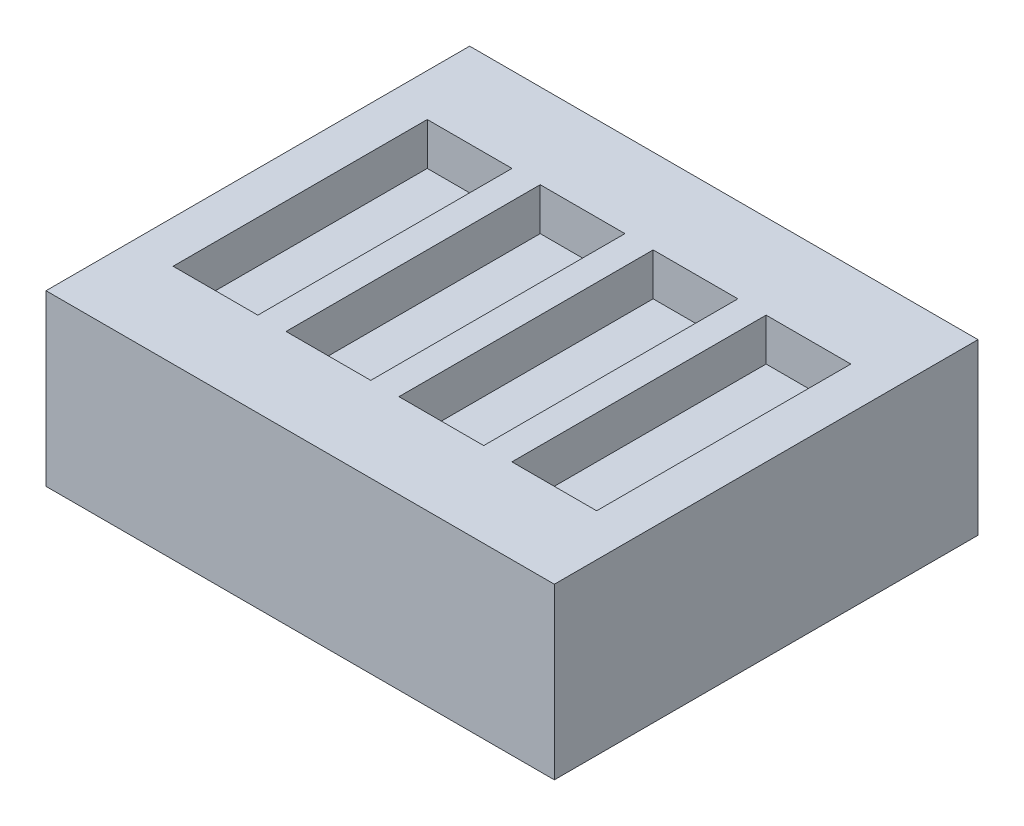
from build123d import *

# Parameters (mm, degrees)
SKETCH1_W           = 6
SKETCH1_H           = 5
BOSS_EXTRUDE1_DEPTH = 2
SKETCH2_W           = 1
SKETCH2_H           = 3
CUT_EXTRUDE1_DEPTH  = 0.5


with BuildPart() as part:
    # Sketch1 → Boss-Extrude1 (new body)
    with BuildSketch(Plane(origin=(0, 0, 0), x_dir=(1, 0, 0), z_dir=(0, 1, 0))):
        with Locations((3, 2.5)):
            Rectangle(SKETCH1_W, SKETCH1_H)
    extrude(amount=BOSS_EXTRUDE1_DEPTH)

    # Sketch2 → Cut-Extrude1 (cut)
    with BuildSketch(Plane(origin=(0, 2, 0), x_dir=(1, 0, 0), z_dir=(0, 1, 0))):
        with Locations((1, 2.5)):
            Rectangle(SKETCH2_W, SKETCH2_H)
        with Locations((2.333, 2.5)):
            Rectangle(SKETCH2_W, SKETCH2_H)
        with Locations((3.666, 2.5)):
            Rectangle(SKETCH2_W, SKETCH2_H)
        with Locations((4.999, 2.5)):
            Rectangle(SKETCH2_W, SKETCH2_H)
    extrude(amount=-CUT_EXTRUDE1_DEPTH, mode=Mode.SUBTRACT)


solid = part.part
